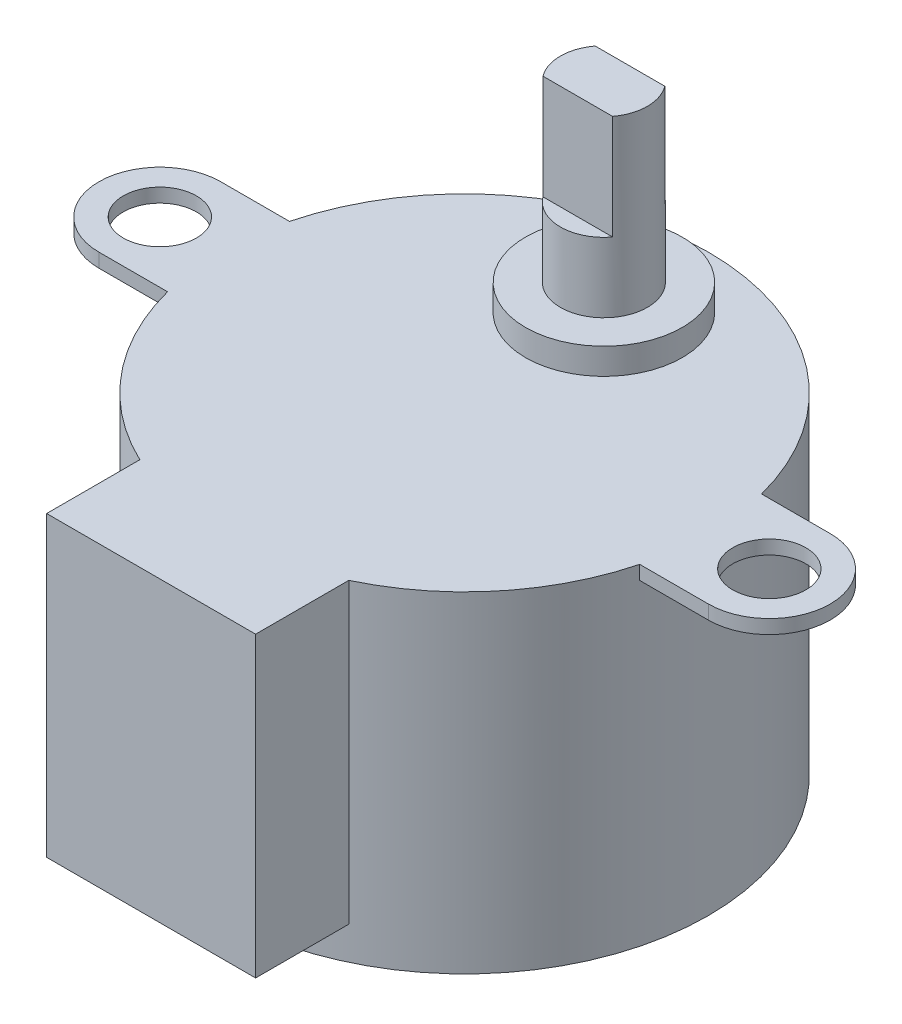
from build123d import *
from build123d.topology import SkipClean

# Parameters (mm, degrees)
CROQUIS1_R                   = 14
SALIENTE_EXTRUIR1_DEPTH      = 19
SALIENTE_EXTRUIR2_START      = -0.8
CROQUIS2_R                   = 2.1
SALIENTE_EXTRUIR2_DEPTH      = 0.8
SALIENTE_EXTRUIR3_REACH      = 51.591
SALIENTE_EXTRUIR3_END_RADIUS = 14
SALIENTE_EXTRUIR3_START      = 18
CROQUIS3_W                   = 12
CROQUIS3_H                   = 17.1
CROQUIS4_R                   = 4.5
SALIENTE_EXTRUIR4_DEPTH      = 1.5
CROQUIS5_R                   = 2.5
SALIENTE_EXTRUIR5_DEPTH      = 10
CROQUIS7_W                   = 6.557991655
CROQUIS7_H                   = 1.368399833
CROQUIS7_W_2                 = 6.403078466
CROQUIS7_H_2                 = 1.988052588
CORTAR_EXTRUIR1_DEPTH        = 6


with BuildPart() as part:
    # Croquis1 → Saliente-Extruir1 (new body)
    with BuildSketch(Plane(origin=(0, 0, 0), x_dir=(1, 0, 0), z_dir=(0, 1, 0))):
        Circle(CROQUIS1_R)
    extrude(amount=SALIENTE_EXTRUIR1_DEPTH)

    # Croquis2 → Saliente-Extruir2 (add)
    with SkipClean():  # the faces are left unmerged after this step: merging them gives an invalid solid
        with BuildSketch(Plane(origin=(0, 19, 0), x_dir=(1, 0, 0), z_dir=(0, 1, 0)).offset(SALIENTE_EXTRUIR2_START)):
            with BuildLine():
                Line((-17.5, 3.5), (-13.555441712, 3.5))
                ThreePointArc((-13.555441712, 3.5), (0, 14), (13.555441712, 3.5))
                Line((13.555441712, 3.5), (17.5, 3.5))
                ThreePointArc((17.5, 3.5), (21, 0), (17.5, -3.5))
                Line((17.5, -3.5), (13.555441712, -3.5))
                ThreePointArc((13.555441712, -3.5), (0, -14), (-13.555441712, -3.5))
                Line((-13.555441712, -3.5), (-17.5, -3.5))
                ThreePointArc((-17.5, -3.5), (-21, 0), (-17.5, 3.5))
            make_face()
            with Locations((-17.5, 0)):
                Circle(CROQUIS2_R, mode=Mode.SUBTRACT)
            with Locations((17.5, 0)):
                Circle(CROQUIS2_R, mode=Mode.SUBTRACT)
        extrude(amount=SALIENTE_EXTRUIR2_DEPTH)

    # Saliente-Extruir3: up to this cylinder (the profile starts outside it)
    with SkipClean():  # the faces are left unmerged after this step: merging them gives an invalid solid
        saliente_extruir3_end = Plane(origin=(0, 10.45, 0), z_dir=(0, -1, 0)) * Cylinder(SALIENTE_EXTRUIR3_END_RADIUS, 132.182, mode=Mode.PRIVATE)
        # Croquis3 → Saliente-Extruir3 (add, up to the surface)
        with BuildSketch(Plane.XY.offset(SALIENTE_EXTRUIR3_START), mode=Mode.PRIVATE) as saliente_extruir3_sk1:
            with Locations((0, 10.45)):
                Rectangle(CROQUIS3_W, CROQUIS3_H)
        saliente_extruir3_tool1 = extrude(saliente_extruir3_sk1.sketch, amount=-SALIENTE_EXTRUIR3_REACH, mode=Mode.PRIVATE) - saliente_extruir3_end
        add(saliente_extruir3_tool1.solids().sort_by_distance((0, 10.45, 18))[0])

    # Croquis4 → Saliente-Extruir4 (add)
    with SkipClean():  # the faces are left unmerged after this step: merging them gives an invalid solid
        with BuildSketch(Plane(origin=(0, 19, 0), x_dir=(1, 0, 0), z_dir=(0, 1, 0))):
            with Locations((0, 8)):
                Circle(CROQUIS4_R)
        extrude(amount=SALIENTE_EXTRUIR4_DEPTH)

    # Croquis5 → Saliente-Extruir5 (add)
    with SkipClean():  # the faces are left unmerged after this step: merging them gives an invalid solid
        with BuildSketch(Plane(origin=(0, 20.5, 0), x_dir=(1, 0, 0), z_dir=(0, 1, 0))):
            with Locations((0, 8)):
                Circle(CROQUIS5_R)
        extrude(amount=SALIENTE_EXTRUIR5_DEPTH)

    # Croquis7 → Cortar-Extruir1 (cut)
    with SkipClean():  # the faces are left unmerged after this step: merging them gives an invalid solid
        with BuildSketch(Plane(origin=(0, 30.5, 0), x_dir=(1, 0, 0), z_dir=(0, 1, 0))):
            with Locations((0.036072912, 10.184199917)):
                Rectangle(CROQUIS7_W, CROQUIS7_H)
            with Locations((-0.041383682, 5.505973706)):
                Rectangle(CROQUIS7_W_2, CROQUIS7_H_2)
        extrude(amount=-CORTAR_EXTRUIR1_DEPTH, mode=Mode.SUBTRACT)


solid = part.part
